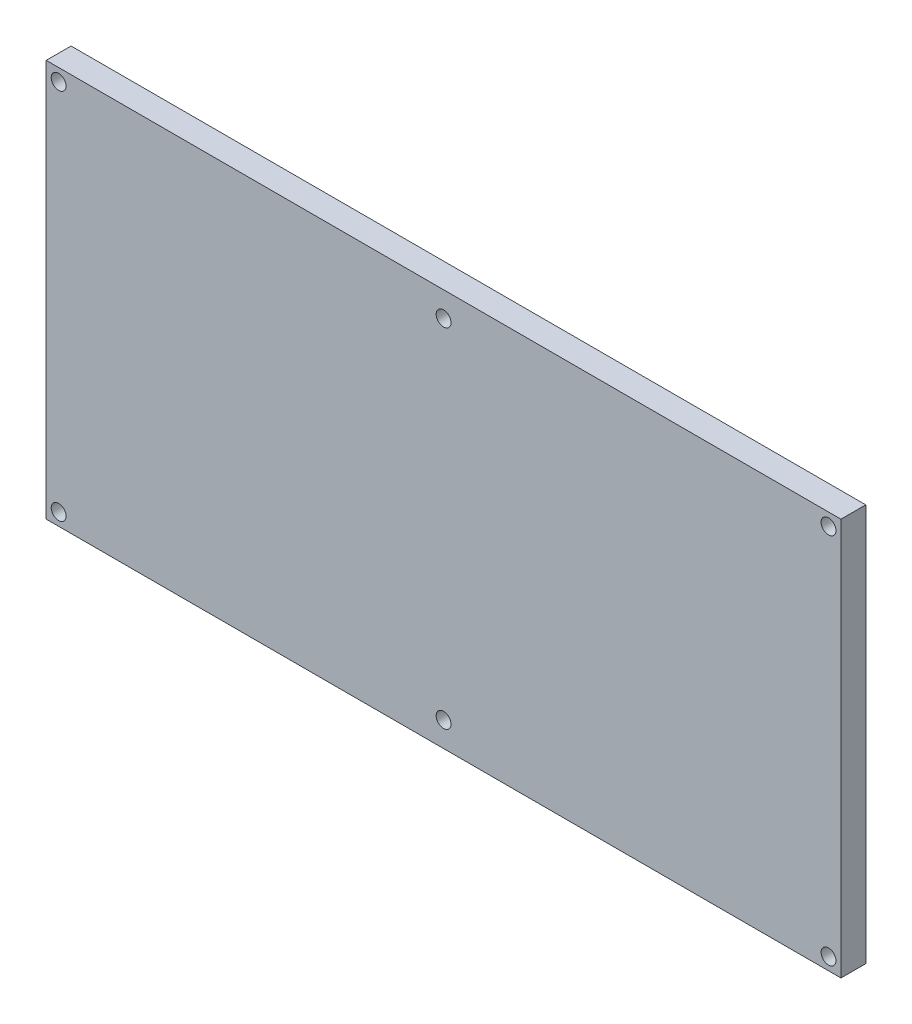
from build123d import *

# Parameters (mm, degrees)
SKETCH1_W             = 203.2
SKETCH1_H             = 101.6
BOSS_EXTRUDE1_DEPTH   = 6.35
F_6_CLEARANCE_HOLE1_D = 3.7973


with BuildPart() as part:
    # Sketch1 → Boss-Extrude1 (new body)
    with BuildSketch(Plane.XY):
        with Locations((101.6, 50.8)):
            Rectangle(SKETCH1_W, SKETCH1_H)
    extrude(amount=BOSS_EXTRUDE1_DEPTH)

    # #6 Clearance Hole1 (through all)
    with Locations(Plane.XY.offset(6.35)):
        with Locations((3.175, 3.175), (3.175, 98.425), (200.025, 98.425), (200.025, 3.175), (101.6, 95.25), (101.6, 6.35)):
            Hole(F_6_CLEARANCE_HOLE1_D / 2)


solid = part.part
